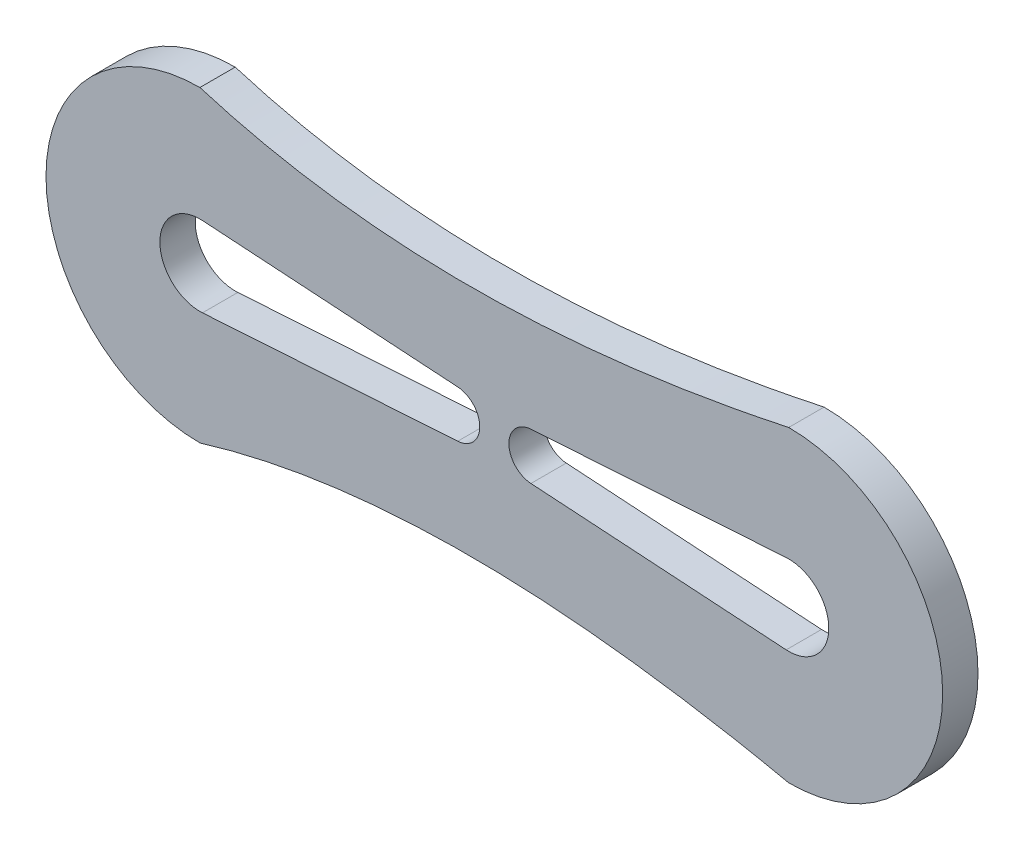
from build123d import *

# Parameters (mm, degrees)
BOSS_EXTRUDE2_DEPTH = 3


with BuildPart() as part:
    # Sketch1 → Boss-Extrude2 (new body)
    with BuildSketch(Plane.XY):
        with BuildLine():
            ThreePointArc((-24.781290204, -3.3929583), (-28.4, 0), (-24.781290204, 3.3929583))
            Line((-24.781290204, 3.3929583), (-12.188441083, 2.581224344))
            ThreePointArc((-12.188441083, 2.581224344), (-14.492522891, 7.771208774), (-18.780288742, 11.494083385))
            add(Edge.make_bspline(
                [(-25, 13.069), (-21.982355601, 12.146946089), (-18.780288742, 11.494083385)],
                knots=[0, 0, 0, 0.145973682, 0.145973682, 0.145973682], degree=2))
            ThreePointArc((-25, 13.069), (-38.069, 0), (-25, -13.069))
            add(Edge.make_bspline(
                [(-25, -13.069), (-21.982355601, -12.146946089), (-18.780288742, -11.494083385)],
                knots=[0, 0, 0, 0.145973682, 0.145973682, 0.145973682], degree=2))
            ThreePointArc((-18.780288742, -11.494083385), (-14.492522891, -7.771208774), (-12.188441083, -2.581224344))
            Line((-12.188441083, -2.581224344), (-24.781290204, -3.3929583))
        make_face()
        with BuildLine():
            ThreePointArc((-18.780288742, 11.494083385), (-14.492522891, 7.771208774), (-12.188441083, 2.581224344))
            Line((-12.188441083, 2.581224344), (-3.107347179, 1.995857823))
            ThreePointArc((-3.107347179, 1.995857823), (-1.236, 0), (-3.107347179, -1.995857823))
            Line((-3.107347179, -1.995857823), (-12.188441083, -2.581224344))
            ThreePointArc((-12.188441083, -2.581224344), (-14.492522891, -7.771208774), (-18.780288742, -11.494083385))
            add(Edge.make_bspline(
                [(-18.780288742, -11.494083385), (-1.944343038, -8.061437688), (19.989933944, -12.070542619)],
                knots=[0.145973682, 0.145973682, 0.145973682, 0.91347951, 0.91347951, 0.91347951], degree=2))
            ThreePointArc((19.989933944, -12.070542619), (14.904735293, -8.299662132), (12.188441083, -2.581224344))
            Line((12.188441083, -2.581224344), (3.107347179, -1.995857823))
            ThreePointArc((3.107347179, -1.995857823), (1.236, 0), (3.107347179, 1.995857823))
            Line((3.107347179, 1.995857823), (12.188441083, 2.581224344))
            ThreePointArc((12.188441083, 2.581224344), (14.904735293, 8.299662132), (19.989933944, 12.070542619))
            add(Edge.make_bspline(
                [(-18.780288742, 11.494083385), (-1.944343038, 8.061437688), (19.989933944, 12.070542619)],
                knots=[0.145973682, 0.145973682, 0.145973682, 0.91347951, 0.91347951, 0.91347951], degree=2))
        make_face()
        with BuildLine():
            add(Edge.make_bspline(
                [(19.989933944, 12.070542619), (22.462572371, 12.522486712), (25, 13.069)],
                knots=[0.91347951, 0.91347951, 0.91347951, 1, 1, 1], degree=2))
            ThreePointArc((19.989933944, 12.070542619), (14.904735293, 8.299662132), (12.188441083, 2.581224344))
            Line((12.188441083, 2.581224344), (24.781290204, 3.3929583))
            ThreePointArc((24.781290204, 3.3929583), (28.4, 0), (24.781290204, -3.3929583))
            Line((24.781290204, -3.3929583), (12.188441083, -2.581224344))
            ThreePointArc((12.188441083, -2.581224344), (14.904735293, -8.299662132), (19.989933944, -12.070542619))
            add(Edge.make_bspline(
                [(19.989933944, -12.070542619), (22.462572371, -12.522486712), (25, -13.069)],
                knots=[0.91347951, 0.91347951, 0.91347951, 1, 1, 1], degree=2))
            ThreePointArc((25, -13.069), (34.241178523, -9.241178523), (38.069, 0))
            ThreePointArc((38.069, 0), (34.241178523, 9.241178523), (25, 13.069))
        make_face()
    extrude(amount=BOSS_EXTRUDE2_DEPTH)


solid = part.part
